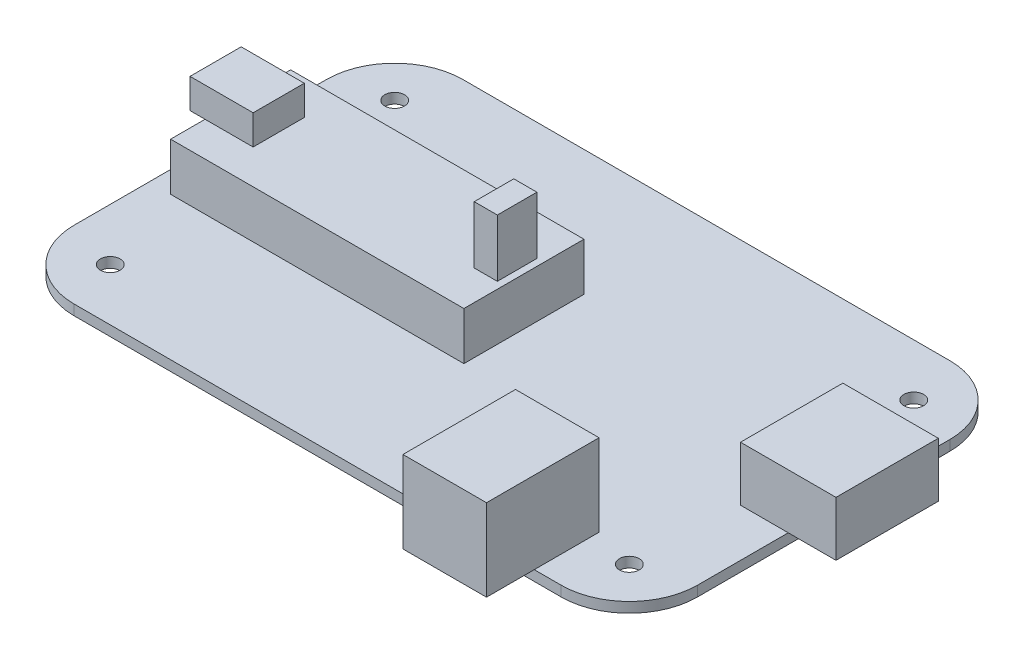
from build123d import *

# Parameters (mm, degrees)
SKETCH1_R           = 1.445
BOSS_EXTRUDE1_DEPTH = 1.5
SKETCH2_W           = 43
SKETCH2_H           = 17.6
BOSS_EXTRUDE2_DEPTH = 7
SKETCH3_W           = 9.25
SKETCH3_H           = 7.5
BOSS_EXTRUDE3_DEPTH = 4.35
SKETCH4_W           = 3.39
SKETCH4_H           = 5.8
BOSS_EXTRUDE4_DEPTH = 8.42
SKETCH5_W           = 14
SKETCH5_H           = 15
BOSS_EXTRUDE5_DEPTH = 8
SKETCH6_W           = 12.25
SKETCH6_H           = 16.5
BOSS_EXTRUDE6_DEPTH = 12


with BuildPart() as part:
    # Sketch1 → Boss-Extrude1 (new body)
    with BuildSketch(Plane(origin=(0, 0, 0), x_dir=(1, 0, 0), z_dir=(0, 1, 0))):
        with BuildLine():
            Line((-35.7, 28.5), (35.7, 28.5))
            ThreePointArc((35.7, 28.5), (42.771067812, 25.571067812), (45.7, 18.5))
            Line((45.7, 18.5), (45.7, -18.5))
            ThreePointArc((45.7, -18.5), (42.771067812, -25.571067812), (35.7, -28.5))
            Line((35.7, -28.5), (-35.7, -28.5))
            ThreePointArc((-35.7, -28.5), (-42.771067812, -25.571067812), (-45.7, -18.5))
            Line((-45.7, -18.5), (-45.7, 18.5))
            ThreePointArc((-45.7, 18.5), (-42.771067812, 25.571067812), (-35.7, 28.5))
        make_face()
        with Locations(Location((-38.05, 20.85, 0), (0, 0, 270))):
            Circle(SKETCH1_R, mode=Mode.SUBTRACT)
        with Locations(Location((-38.05, -20.85, 0), (0, 0, 270))):
            Circle(SKETCH1_R, mode=Mode.SUBTRACT)
        with Locations(Location((38.05, 20.85, 0), (0, 0, 270))):
            Circle(SKETCH1_R, mode=Mode.SUBTRACT)
        with Locations(Location((38.05, -20.85, 0), (0, 0, 270))):
            Circle(SKETCH1_R, mode=Mode.SUBTRACT)
    extrude(amount=BOSS_EXTRUDE1_DEPTH)

    # Sketch2 → Boss-Extrude2 (add)
    with BuildSketch(Plane(origin=(0, 1.5, 0), x_dir=(1, 0, 0), z_dir=(0, 1, 0))):
        with Locations((-21.05, 1.3)):
            Rectangle(SKETCH2_W, SKETCH2_H)
    extrude(amount=BOSS_EXTRUDE2_DEPTH)

    # Sketch3 → Boss-Extrude3 (add)
    with BuildSketch(Plane(origin=(0, 8.5, 0), x_dir=(1, 0, 0), z_dir=(0, 1, 0))):
        with Locations((-40.125, 1.3)):
            Rectangle(SKETCH3_W, SKETCH3_H)
    extrude(amount=BOSS_EXTRUDE3_DEPTH)

    # Sketch4 → Boss-Extrude4 (add)
    with BuildSketch(Plane(origin=(0, 8.5, 0), x_dir=(1, 0, 0), z_dir=(0, 1, 0))):
        with Locations((-2.245, 1.3)):
            Rectangle(SKETCH4_W, SKETCH4_H)
    extrude(amount=BOSS_EXTRUDE4_DEPTH)

    # Sketch5 → Boss-Extrude5 (add)
    with BuildSketch(Plane(origin=(0, 1.5, 0), x_dir=(1, 0, 0), z_dir=(0, 1, 0))):
        with Locations((45.7, 2.3)):
            Rectangle(SKETCH5_W, SKETCH5_H)
    extrude(amount=BOSS_EXTRUDE5_DEPTH)

    # Sketch6 → Boss-Extrude6 (add)
    with BuildSketch(Plane(origin=(0, 1.5, 0), x_dir=(1, 0, 0), z_dir=(0, 1, 0))):
        with Locations((25.637075285, -27.25)):
            Rectangle(SKETCH6_W, SKETCH6_H)
    extrude(amount=BOSS_EXTRUDE6_DEPTH)


solid = part.part
